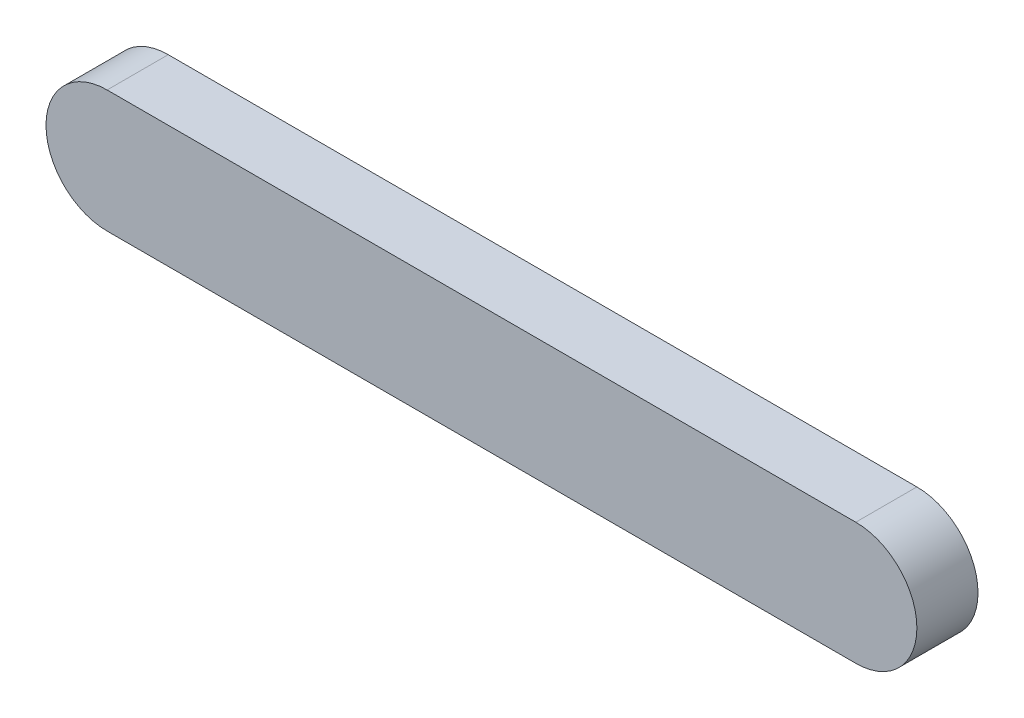
from build123d import *

# Parameters (mm, degrees)
EXTRUDE_1_DEPTH = 20


with BuildPart() as part:
    # 草图1 → 凸台-拉伸1 (new body)
    with BuildSketch(Plane.XY):
        with BuildLine():
            Line((0, 20), (245, 20))
            ThreePointArc((245, 20), (265, 0), (245, -20))
            Line((245, -20), (0, -20))
            ThreePointArc((0, -20), (-20, 0), (0, 20))
        make_face()
    extrude(amount=EXTRUDE_1_DEPTH)


solid = part.part
